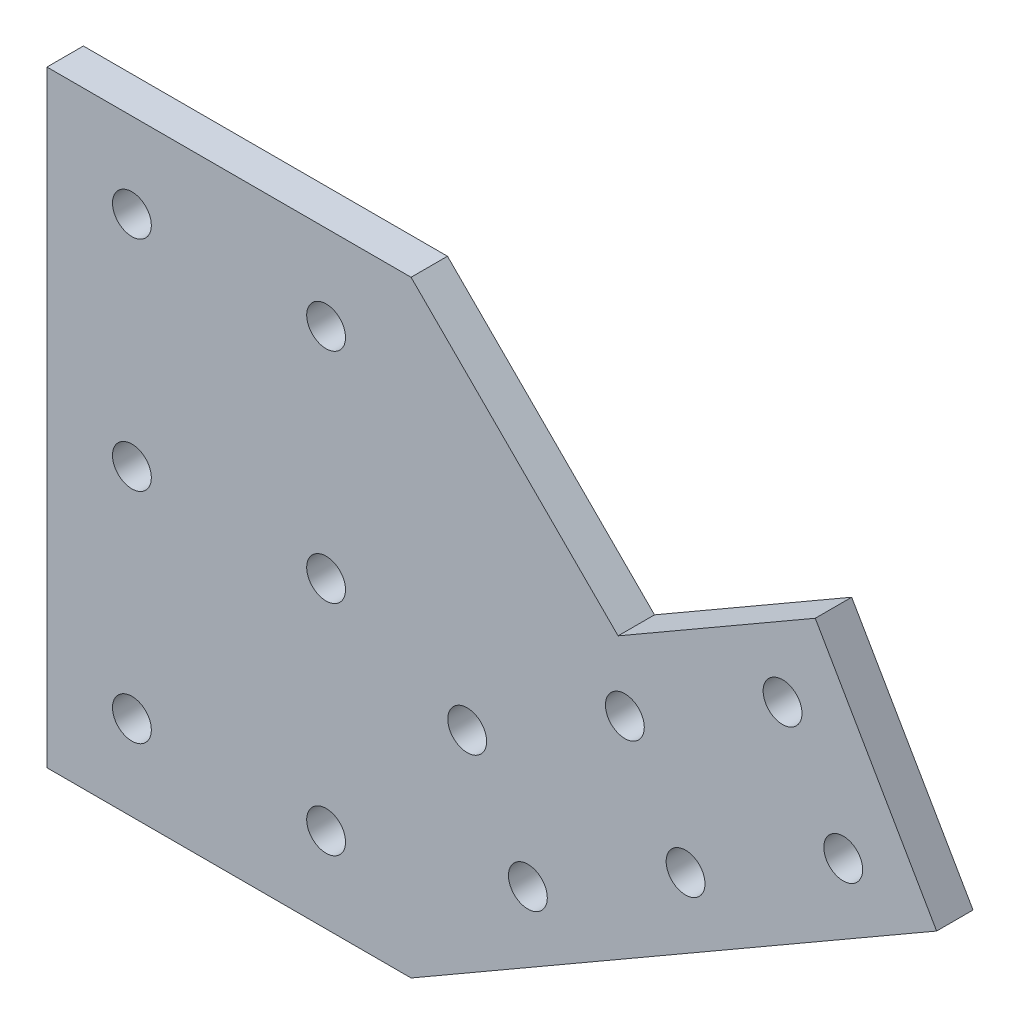
from build123d import *

# Parameters (mm, degrees)
EXTRUDE_1_DEPTH     = 3
SKETCH_2_R          = 1.6
CUT_EXTRUDE_1_DEPTH = 67.211781429


with BuildPart() as part:
    # 草图1 → 凸台-拉伸1 (new body)
    with BuildSketch(Plane.XY):
        Polygon((0, 0), (-30, 0), (-30, 50), (0, 50), (17.057713659, 32.942286341), (33.301270189, 42.320508076), (43.301270189, 25), align=None)
    extrude(amount=EXTRUDE_1_DEPTH)

    # 草图2 → 切除-拉伸1 (cut, through all)
    with BuildSketch(Plane.XY.offset(3)):
        with Locations((-23, 43)):
            Circle(SKETCH_2_R)
        with Locations((-7, 43)):
            Circle(SKETCH_2_R)
        with Locations((-23, 7)):
            Circle(SKETCH_2_R)
        with Locations((-7, 7)):
            Circle(SKETCH_2_R)
        with Locations((-23, 25)):
            Circle(SKETCH_2_R)
        with Locations((-7, 25)):
            Circle(SKETCH_2_R)
        with Locations((30.605117767, 34.990381057)):
            Circle(SKETCH_2_R)
        with Locations((35.605117767, 26.330127019)):
            Circle(SKETCH_2_R)
        with Locations((22.61473671, 18.830127019)):
            Circle(SKETCH_2_R)
        with Locations((17.61473671, 27.490381057)):
            Circle(SKETCH_2_R)
        with Locations((4.624355653, 19.990381057)):
            Circle(SKETCH_2_R)
        with Locations((9.624355653, 11.330127019)):
            Circle(SKETCH_2_R)
    extrude(amount=-CUT_EXTRUDE_1_DEPTH, mode=Mode.SUBTRACT)


solid = part.part
